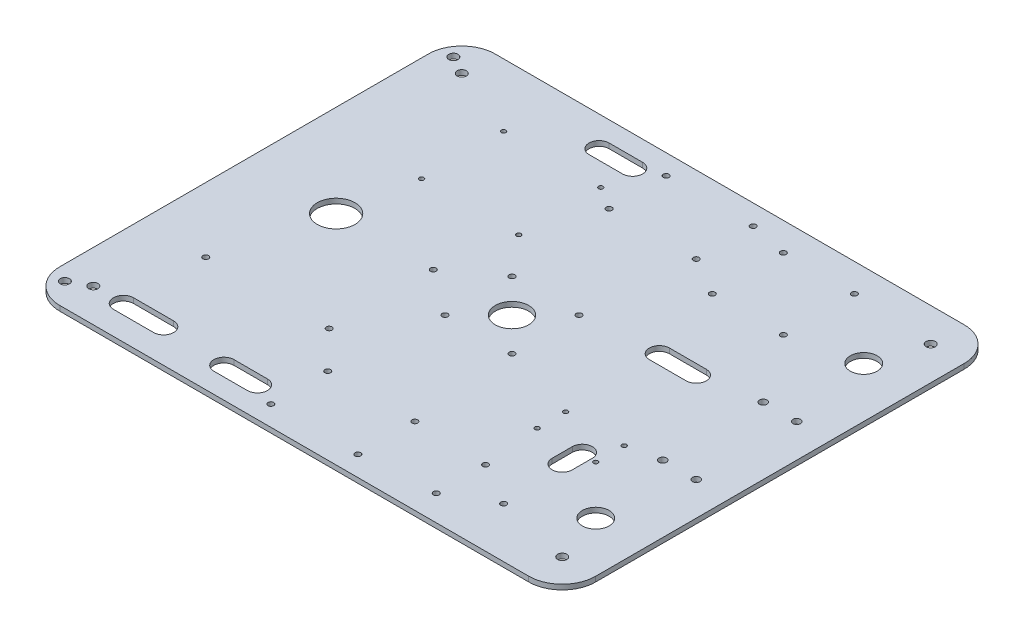
from build123d import *

# Parameters (mm, degrees)
PLATE_DEPTH                    = 3
CUT_DECKPOSTS_M5_DEPTH         = 207.177108332
CUT_DECKPOSTS_M5_DEPTH_BACK    = 207.177108332
SK_DECKPOSTS_M5_R              = 2.75
CUT_LIDARRISER_M3_DEPTH        = 207.177108332
CUT_LIDARRISER_M3_DEPTH_BACK   = 207.177108332
SK_LIDARRISER_M3_R             = 1.7
CUT_LIDARCABLE_20_DEPTH        = 207.177108332
CUT_LIDARCABLE_20_DEPTH_BACK   = 207.177108332
SK_LIDARCABLE_20_R             = 10
CUT_PI5_M2P5_DEPTH             = 207.177108332
CUT_PI5_M2P5_DEPTH_BACK        = 207.177108332
SK_PI5_M2P5_R                  = 1.35
CUT_ESP32CARRIER_M3_DEPTH      = 207.177108332
CUT_ESP32CARRIER_M3_DEPTH_BACK = 207.177108332
SK_ESP32CARRIER_M3_R           = 1.7
CUT_ESTOP_22P5_DEPTH           = 207.177108332
CUT_ESTOP_22P5_DEPTH_BACK      = 207.177108332
SK_ESTOP_22P5_R                = 11.25
CUT_CAMERA_M4_DEPTH            = 207.177108332
CUT_CAMERA_M4_DEPTH_BACK       = 207.177108332
SK_CAMERA_M4_R                 = 2.25
CUT_LIGHTS_16_DEPTH            = 207.177108332
CUT_LIGHTS_16_DEPTH_BACK       = 207.177108332
SK_LIGHTS_16_R                 = 8
CUT_HANDLE_M5_DEPTH            = 207.177108332
CUT_HANDLE_M5_DEPTH_BACK       = 207.177108332
SK_HANDLE_M5_R                 = 2.75
CUT_POWERBLOCKS_M3_DEPTH       = 207.177108332
CUT_POWERBLOCKS_M3_DEPTH_BACK  = 207.177108332
SK_POWERBLOCKS_M3_R            = 1.7
CUT_K2RELAY_M2P5_DEPTH         = 207.177108332
CUT_K2RELAY_M2P5_DEPTH_BACK    = 207.177108332
SK_K2RELAY_M2P5_R              = 1.35
CUT_LIDARSPLICE_M3_DEPTH       = 207.177108332
CUT_LIDARSPLICE_M3_DEPTH_BACK  = 207.177108332
SK_LIDARSPLICE_M3_R            = 1.7
CUT_MICARRAY_M3_DEPTH          = 207.177108332
CUT_MICARRAY_M3_DEPTH_BACK     = 207.177108332
SK_MICARRAY_M3_R               = 1.7
CUT_SPEAKER_M3_DEPTH           = 207.177108332
CUT_SPEAKER_M3_DEPTH_BACK      = 207.177108332
SK_SPEAKER_M3_R                = 1.7
CUT_PASSTHROUGHS_DEPTH         = 207.177108332
CUT_PASSTHROUGHS_DEPTH_BACK    = 207.177108332


with BuildPart() as part:
    # SK_Outline → Plate (new body)
    with BuildSketch(Plane(origin=(0, 0, 0), x_dir=(1, 0, 0), z_dir=(0, 1, 0))):
        with BuildLine():
            Line((160, -110), (160, 110))
            ThreePointArc((160, 110), (154.142135624, 124.142135624), (140, 130))
            Line((140, 130), (-140, 130))
            ThreePointArc((-140, 130), (-154.142135624, 124.142135624), (-160, 110))
            Line((-160, 110), (-160, -110))
            ThreePointArc((-160, -110), (-154.142135624, -124.142135624), (-140, -130))
            Line((-140, -130), (140, -130))
            ThreePointArc((140, -130), (154.142135624, -124.142135624), (160, -110))
        make_face()
    extrude(amount=PLATE_DEPTH)

    # SK_DeckPosts_M5 → Cut_DeckPosts_M5 (cut, two sides: drawn at the far end of the back side and taken through both)
    with BuildSketch(Plane(origin=(0, 0, 0), x_dir=(1, 0, 0), z_dir=(0, 1, 0)).offset(-CUT_DECKPOSTS_M5_DEPTH_BACK)):
        with Locations(Location((140, -110, 0), (0, 0, 270))):
            Circle(SK_DECKPOSTS_M5_R)
        with Locations(Location((140, 110, 0), (0, 0, 270))):
            Circle(SK_DECKPOSTS_M5_R)
        with Locations(Location((-140, -110, 0), (0, 0, 270))):
            Circle(SK_DECKPOSTS_M5_R)
        with Locations(Location((-140, 110, 0), (0, 0, 270))):
            Circle(SK_DECKPOSTS_M5_R)
    extrude(amount=CUT_DECKPOSTS_M5_DEPTH + CUT_DECKPOSTS_M5_DEPTH_BACK, mode=Mode.SUBTRACT)

    # SK_LidarRiser_M3 → Cut_LidarRiser_M3 (cut, two sides: drawn at the far end of the back side and taken through both)
    with BuildSketch(Plane(origin=(0, 0, 0), x_dir=(1, 0, 0), z_dir=(0, 1, 0)).offset(-CUT_LIDARRISER_M3_DEPTH_BACK)):
        with Locations(Location((20, -20, 0), (0, 0, 270))):
            Circle(SK_LIDARRISER_M3_R)
        with Locations(Location((20, 20, 0), (0, 0, 270))):
            Circle(SK_LIDARRISER_M3_R)
        with Locations(Location((-20, -20, 0), (0, 0, 270))):
            Circle(SK_LIDARRISER_M3_R)
        with Locations(Location((-20, 20, 0), (0, 0, 270))):
            Circle(SK_LIDARRISER_M3_R)
    extrude(amount=CUT_LIDARRISER_M3_DEPTH + CUT_LIDARRISER_M3_DEPTH_BACK, mode=Mode.SUBTRACT)

    # SK_LidarCable_20 → Cut_LidarCable_20 (cut, two sides: drawn at the far end of the back side and taken through both)
    with BuildSketch(Plane(origin=(0, 0, 0), x_dir=(1, 0, 0), z_dir=(0, 1, 0)).offset(-CUT_LIDARCABLE_20_DEPTH_BACK)):
        with Locations(Location((0, 0, 0), (0, 0, 270))):
            Circle(SK_LIDARCABLE_20_R)
    extrude(amount=CUT_LIDARCABLE_20_DEPTH + CUT_LIDARCABLE_20_DEPTH_BACK, mode=Mode.SUBTRACT)

    # SK_Pi5_M2p5 → Cut_Pi5_M2p5 (cut, two sides: drawn at the far end of the back side and taken through both)
    with BuildSketch(Plane(origin=(0, 0, 0), x_dir=(1, 0, 0), z_dir=(0, 1, 0)).offset(-CUT_PI5_M2P5_DEPTH_BACK)):
        with Locations(Location((-97.5, 92.5, 0), (0, 0, 270))):
            Circle(SK_PI5_M2P5_R)
        with Locations(Location((-97.5, 43.5, 0), (0, 0, 270))):
            Circle(SK_PI5_M2P5_R)
        with Locations(Location((-39.5, 92.5, 0), (0, 0, 270))):
            Circle(SK_PI5_M2P5_R)
        with Locations(Location((-39.5, 43.5, 0), (0, 0, 270))):
            Circle(SK_PI5_M2P5_R)
    extrude(amount=CUT_PI5_M2P5_DEPTH + CUT_PI5_M2P5_DEPTH_BACK, mode=Mode.SUBTRACT)

    # SK_ESP32Carrier_M3 → Cut_ESP32Carrier_M3 (cut, two sides: drawn at the far end of the back side and taken through both)
    with BuildSketch(Plane(origin=(0, 0, 0), x_dir=(1, 0, 0), z_dir=(0, 1, 0)).offset(-CUT_ESP32CARRIER_M3_DEPTH_BACK)):
        with Locations(Location((-121.35, -61.5, 0), (0, 0, 270))):
            Circle(SK_ESP32CARRIER_M3_R)
        with Locations(Location((-47.65, -61.5, 0), (0, 0, 270))):
            Circle(SK_ESP32CARRIER_M3_R)
    extrude(amount=CUT_ESP32CARRIER_M3_DEPTH + CUT_ESP32CARRIER_M3_DEPTH_BACK, mode=Mode.SUBTRACT)

    # SK_EStop_22p5 → Cut_EStop_22p5 (cut, two sides: drawn at the far end of the back side and taken through both)
    with BuildSketch(Plane(origin=(0, 0, 0), x_dir=(1, 0, 0), z_dir=(0, 1, 0)).offset(-CUT_ESTOP_22P5_DEPTH_BACK)):
        with Locations(Location((-105, 0, 0), (0, 0, 270))):
            Circle(SK_ESTOP_22P5_R)
    extrude(amount=CUT_ESTOP_22P5_DEPTH + CUT_ESTOP_22P5_DEPTH_BACK, mode=Mode.SUBTRACT)

    # SK_Camera_M4 → Cut_Camera_M4 (cut, two sides: drawn at the far end of the back side and taken through both)
    with BuildSketch(Plane(origin=(0, 0, 0), x_dir=(1, 0, 0), z_dir=(0, 1, 0)).offset(-CUT_CAMERA_M4_DEPTH_BACK)):
        with Locations(Location((120, -30, 0), (0, 0, 270))):
            Circle(SK_CAMERA_M4_R)
        with Locations(Location((120, 30, 0), (0, 0, 270))):
            Circle(SK_CAMERA_M4_R)
        with Locations(Location((140, -30, 0), (0, 0, 270))):
            Circle(SK_CAMERA_M4_R)
        with Locations(Location((140, 30, 0), (0, 0, 270))):
            Circle(SK_CAMERA_M4_R)
    extrude(amount=CUT_CAMERA_M4_DEPTH + CUT_CAMERA_M4_DEPTH_BACK, mode=Mode.SUBTRACT)

    # SK_Lights_16 → Cut_Lights_16 (cut, two sides: drawn at the far end of the back side and taken through both)
    with BuildSketch(Plane(origin=(0, 0, 0), x_dir=(1, 0, 0), z_dir=(0, 1, 0)).offset(-CUT_LIGHTS_16_DEPTH_BACK)):
        with Locations(Location((130, -80, 0), (0, 0, 270))):
            Circle(SK_LIGHTS_16_R)
        with Locations(Location((130, 80, 0), (0, 0, 270))):
            Circle(SK_LIGHTS_16_R)
    extrude(amount=CUT_LIGHTS_16_DEPTH + CUT_LIGHTS_16_DEPTH_BACK, mode=Mode.SUBTRACT)

    # SK_Handle_M5 → Cut_Handle_M5 (cut, two sides: drawn at the far end of the back side and taken through both)
    with BuildSketch(Plane(origin=(0, 0, 0), x_dir=(1, 0, 0), z_dir=(0, 1, 0)).offset(-CUT_HANDLE_M5_DEPTH_BACK)):
        with Locations(Location((-151, -116, 0), (0, 0, 270))):
            Circle(SK_HANDLE_M5_R)
        with Locations(Location((-151, 116, 0), (0, 0, 270))):
            Circle(SK_HANDLE_M5_R)
    extrude(amount=CUT_HANDLE_M5_DEPTH + CUT_HANDLE_M5_DEPTH_BACK, mode=Mode.SUBTRACT)

    # SK_PowerBlocks_M3 → Cut_PowerBlocks_M3 (cut, two sides: drawn at the far end of the back side and taken through both)
    with BuildSketch(Plane(origin=(0, 0, 0), x_dir=(1, 0, 0), z_dir=(0, 1, 0)).offset(-CUT_POWERBLOCKS_M3_DEPTH_BACK)):
        with Locations(Location((-26, -84, 0), (0, 0, 270))):
            Circle(SK_POWERBLOCKS_M3_R)
        with Locations(Location((-26, -118, 0), (0, 0, 270))):
            Circle(SK_POWERBLOCKS_M3_R)
        with Locations(Location((26, -84, 0), (0, 0, 270))):
            Circle(SK_POWERBLOCKS_M3_R)
        with Locations(Location((26, -118, 0), (0, 0, 270))):
            Circle(SK_POWERBLOCKS_M3_R)
        with Locations(Location((-26, 84, 0), (0, 0, 270))):
            Circle(SK_POWERBLOCKS_M3_R)
        with Locations(Location((-26, 118, 0), (0, 0, 270))):
            Circle(SK_POWERBLOCKS_M3_R)
        with Locations(Location((26, 84, 0), (0, 0, 270))):
            Circle(SK_POWERBLOCKS_M3_R)
        with Locations(Location((26, 118, 0), (0, 0, 270))):
            Circle(SK_POWERBLOCKS_M3_R)
    extrude(amount=CUT_POWERBLOCKS_M3_DEPTH + CUT_POWERBLOCKS_M3_DEPTH_BACK, mode=Mode.SUBTRACT)

    # SK_K2Relay_M2p5 → Cut_K2Relay_M2p5 (cut, two sides: drawn at the far end of the back side and taken through both)
    with BuildSketch(Plane(origin=(0, 0, 0), x_dir=(1, 0, 0), z_dir=(0, 1, 0)).offset(-CUT_K2RELAY_M2P5_DEPTH_BACK)):
        with Locations(Location((66, -34, 0), (0, 0, 270))):
            Circle(SK_K2RELAY_M2P5_R)
        with Locations(Location((66, -51, 0), (0, 0, 270))):
            Circle(SK_K2RELAY_M2P5_R)
        with Locations(Location((101, -34, 0), (0, 0, 270))):
            Circle(SK_K2RELAY_M2P5_R)
        with Locations(Location((101, -51, 0), (0, 0, 270))):
            Circle(SK_K2RELAY_M2P5_R)
    extrude(amount=CUT_K2RELAY_M2P5_DEPTH + CUT_K2RELAY_M2P5_DEPTH_BACK, mode=Mode.SUBTRACT)

    # SK_LidarSplice_M3 → Cut_LidarSplice_M3 (cut, two sides: drawn at the far end of the back side and taken through both)
    with BuildSketch(Plane(origin=(0, 0, 0), x_dir=(1, 0, 0), z_dir=(0, 1, 0)).offset(-CUT_LIDARSPLICE_M3_DEPTH_BACK)):
        with Locations(Location((-47, 0, 0), (0, 0, 270))):
            Circle(SK_LIDARSPLICE_M3_R)
    extrude(amount=CUT_LIDARSPLICE_M3_DEPTH + CUT_LIDARSPLICE_M3_DEPTH_BACK, mode=Mode.SUBTRACT)

    # SK_MicArray_M3 → Cut_MicArray_M3 (cut, two sides: drawn at the far end of the back side and taken through both)
    with BuildSketch(Plane(origin=(0, 0, 0), x_dir=(1, 0, 0), z_dir=(0, 1, 0)).offset(-CUT_MICARRAY_M3_DEPTH_BACK)):
        with Locations(Location((91.222, 70.795, 0), (0, 0, 270))):
            Circle(SK_MICARRAY_M3_R)
        with Locations(Location((48.791, 70.783, 0), (0, 0, 270))):
            Circle(SK_MICARRAY_M3_R)
        with Locations(Location((48.787, 113.213, 0), (0, 0, 270))):
            Circle(SK_MICARRAY_M3_R)
        with Locations(Location((91.218, 113.209, 0), (0, 0, 270))):
            Circle(SK_MICARRAY_M3_R)
    extrude(amount=CUT_MICARRAY_M3_DEPTH + CUT_MICARRAY_M3_DEPTH_BACK, mode=Mode.SUBTRACT)

    # SK_Speaker_M3 → Cut_Speaker_M3 (cut, two sides: drawn at the far end of the back side and taken through both)
    with BuildSketch(Plane(origin=(0, 0, 0), x_dir=(1, 0, 0), z_dir=(0, 1, 0)).offset(-CUT_SPEAKER_M3_DEPTH_BACK)):
        with Locations(Location((95, -100, 0), (0, 0, 270))):
            Circle(SK_SPEAKER_M3_R)
        with Locations(Location((69.506, -114.726, 0), (0, 0, 270))):
            Circle(SK_SPEAKER_M3_R)
        with Locations(Location((69.503, -85.276, 0), (0, 0, 270))):
            Circle(SK_SPEAKER_M3_R)
    extrude(amount=CUT_SPEAKER_M3_DEPTH + CUT_SPEAKER_M3_DEPTH_BACK, mode=Mode.SUBTRACT)

    # SK_PassThroughs → Cut_PassThroughs (cut, two sides: drawn at the far end of the back side and taken through both)
    with BuildSketch(Plane(origin=(0, 0, 0), x_dir=(1, 0, 0), z_dir=(0, 1, 0)).offset(-CUT_PASSTHROUGHS_DEPTH_BACK)):
        with BuildLine():
            Line((-60, 118), (-40, 118))
            ThreePointArc((-40, 118), (-34, 112), (-40, 106))
            Line((-40, 106), (-60, 106))
            ThreePointArc((-60, 106), (-66, 112), (-60, 118))
        make_face()
        with BuildLine():
            Line((-60, -106), (-40, -106))
            ThreePointArc((-40, -106), (-34, -112), (-40, -118))
            Line((-40, -118), (-60, -118))
            ThreePointArc((-60, -118), (-66, -112), (-60, -106))
        make_face()
        with BuildLine():
            Line((-122, -104), (-98, -104))
            ThreePointArc((-98, -104), (-92, -110), (-98, -116))
            Line((-98, -116), (-122, -116))
            ThreePointArc((-122, -116), (-128, -110), (-122, -104))
        make_face()
        with BuildLine():
            Line((64, 30), (86, 30))
            ThreePointArc((86, 30), (92, 24), (86, 18))
            Line((86, 18), (64, 18))
            ThreePointArc((64, 18), (58, 24), (64, 30))
        make_face()
        with BuildLine():
            Line((98, -50), (98, -62))
            ThreePointArc((98, -62), (92, -68), (86, -62))
            Line((86, -62), (86, -50))
            ThreePointArc((86, -50), (92, -44), (98, -50))
        make_face()
    extrude(amount=CUT_PASSTHROUGHS_DEPTH + CUT_PASSTHROUGHS_DEPTH_BACK, mode=Mode.SUBTRACT)


solid = part.part
